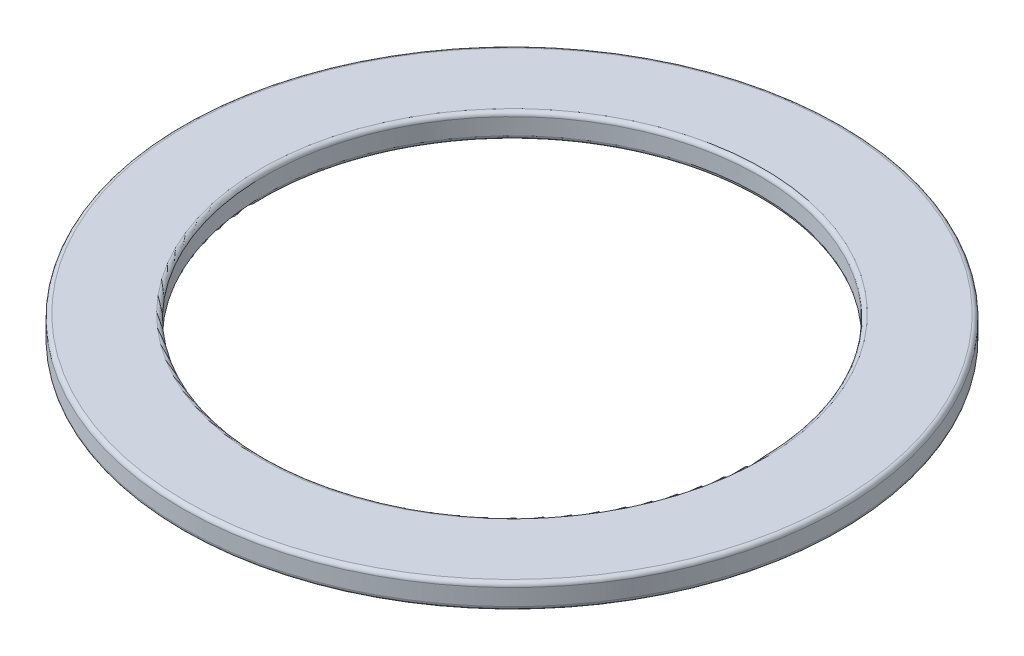
from build123d import *

# Parameters (mm, degrees)
SKETCH_1_R      = 4
SKETCH_1_R_2    = 3
EXTRUDE_1_DEPTH = 0.3
FILLET_2_R      = 0.05


with BuildPart() as part:
    # 草图1 → 凸台-拉伸1 (new body)
    with BuildSketch(Plane(origin=(0, 0, 0), x_dir=(1, 0, 0), z_dir=(0, 1, 0))):
        with Locations(Location((0, 0, 0), (0, 0, 270))):
            Circle(SKETCH_1_R)
        with Locations(Location((0, 0, 0), (0, 0, 270))):
            Circle(SKETCH_1_R_2, mode=Mode.SUBTRACT)
    extrude(amount=EXTRUDE_1_DEPTH)

    # 圆角2
    fillet_2_edges = [part.edges().sort_by_distance(p)[0] for p in [
        (0, 0, -4),
        (0, 0.3, -4),
        (0, 0, -3),
        (0, 0.3, -3),
    ]]
    fillet(fillet_2_edges, radius=FILLET_2_R)


solid = part.part
